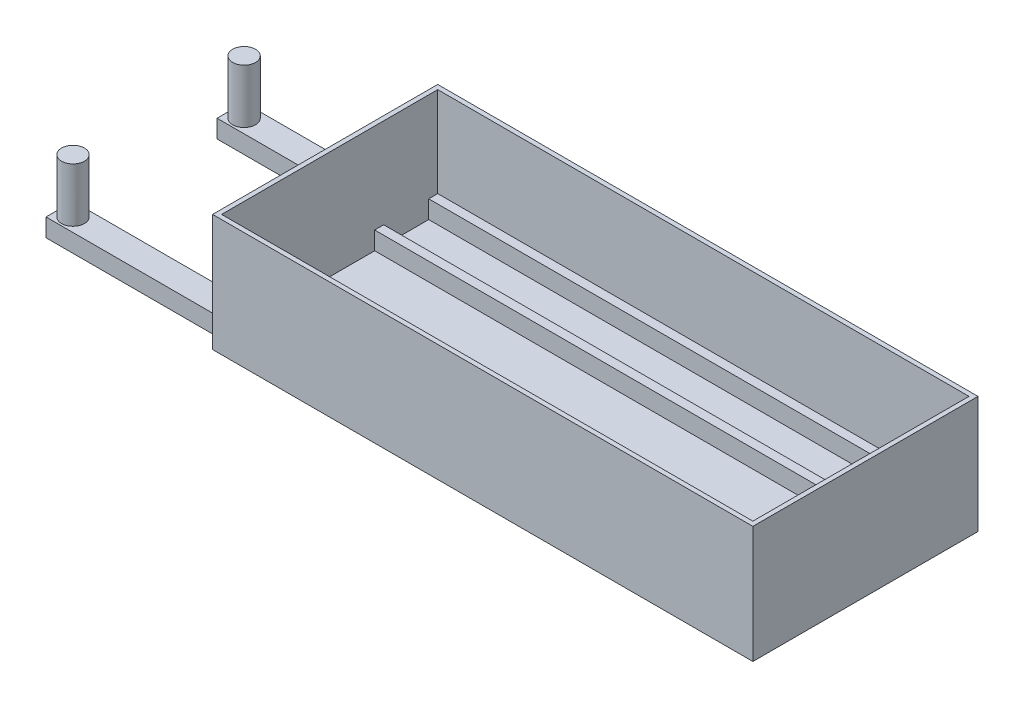
from build123d import *

# Parameters (mm, degrees)
SKETCH1_W           = 600
SKETCH1_H           = 250
BOSS_EXTRUDE1_DEPTH = 130
SKETCH2_W           = 590
SKETCH2_H           = 240
CUT_EXTRUDE1_DEPTH  = 120
SKETCH3_W           = 590
SKETCH3_H           = 10
BOSS_EXTRUDE2_DEPTH = 20
SKETCH4_W           = 30
SKETCH4_H           = 20
SKETCH4_H_2         = 20.05334452
BOSS_EXTRUDE3_DEPTH = 200
SKETCH5_R           = 12.7
BOSS_EXTRUDE4_DEPTH = 60


with BuildPart() as part:
    # Sketch1 → Boss-Extrude1 (new body)
    with BuildSketch(Plane(origin=(0, 0, 0), x_dir=(1, 0, 0), z_dir=(0, 1, 0))):
        Rectangle(SKETCH1_W, SKETCH1_H)
    extrude(amount=BOSS_EXTRUDE1_DEPTH)

    # Sketch2 → Cut-Extrude1 (cut)
    with BuildSketch(Plane(origin=(0, 130, 0), x_dir=(1, 0, 0), z_dir=(0, 1, 0))):
        Rectangle(SKETCH2_W, SKETCH2_H)
    extrude(amount=-CUT_EXTRUDE1_DEPTH, mode=Mode.SUBTRACT)

    # Sketch3 → Boss-Extrude2 (add)
    with BuildSketch(Plane(origin=(0, 10, 0), x_dir=(1, 0, 0), z_dir=(0, 1, 0))):
        with Locations((0, -115)):
            Rectangle(SKETCH3_W, SKETCH3_H)
        with Locations((0, -55)):
            Rectangle(SKETCH3_W, SKETCH3_H)
        with Locations((0, 55)):
            Rectangle(SKETCH3_W, SKETCH3_H)
        with Locations((0, 115)):
            Rectangle(SKETCH3_W, SKETCH3_H)
    extrude(amount=BOSS_EXTRUDE2_DEPTH)

    # Sketch4 → Boss-Extrude3 (add)
    with BuildSketch(Plane.ZY.offset(300)):
        with Locations((-95, 10)):
            Rectangle(SKETCH4_W, SKETCH4_H)
        with Locations((95, 10.02667226)):
            Rectangle(SKETCH4_W, SKETCH4_H_2)
    extrude(amount=BOSS_EXTRUDE3_DEPTH)

    # Sketch5 → Boss-Extrude4 (add)
    with BuildSketch(Plane(origin=(0, 20, 0), x_dir=(1, 0, 0), z_dir=(0, 1, 0))):
        with Locations(Location((-485, -95, 0), (0, 0, 90))):
            Circle(SKETCH5_R)
        with Locations(Location((-485, 95, 0), (0, 0, 270))):
            Circle(SKETCH5_R)
    extrude(amount=BOSS_EXTRUDE4_DEPTH)


solid = part.part
